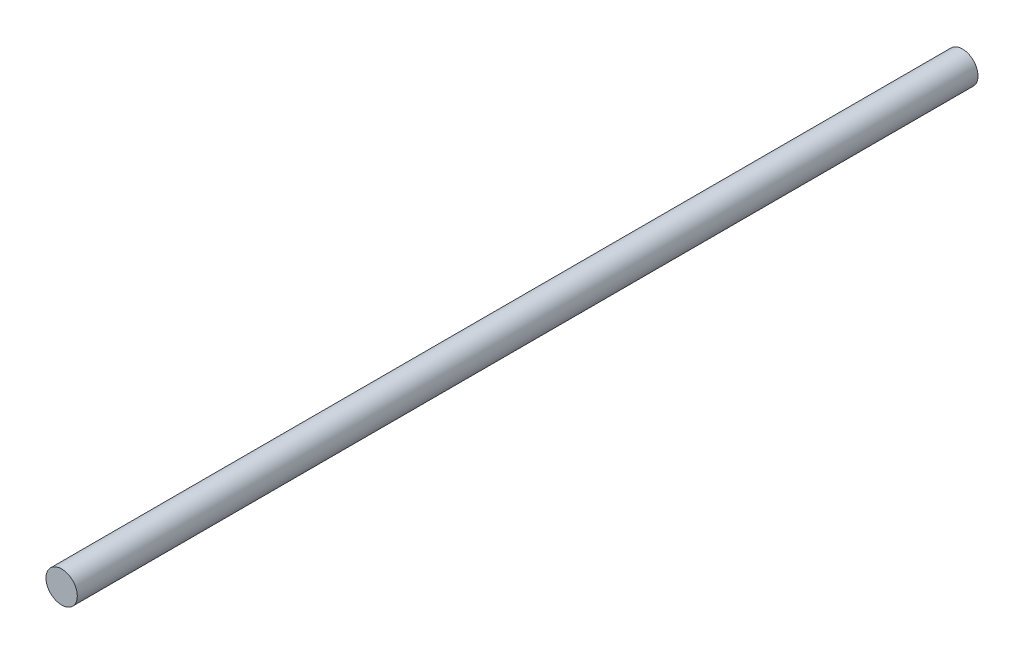
from build123d import *

# Parameters (mm, degrees)
SKETCH_1_R      = 4
EXTRUDE_1_DEPTH = 115


with BuildPart() as part:
    # 草图1 → 凸台-拉伸1 (new, symmetric)
    with BuildSketch(Plane.XY):
        Circle(SKETCH_1_R)
    extrude(amount=EXTRUDE_1_DEPTH, both=True)


solid = part.part
